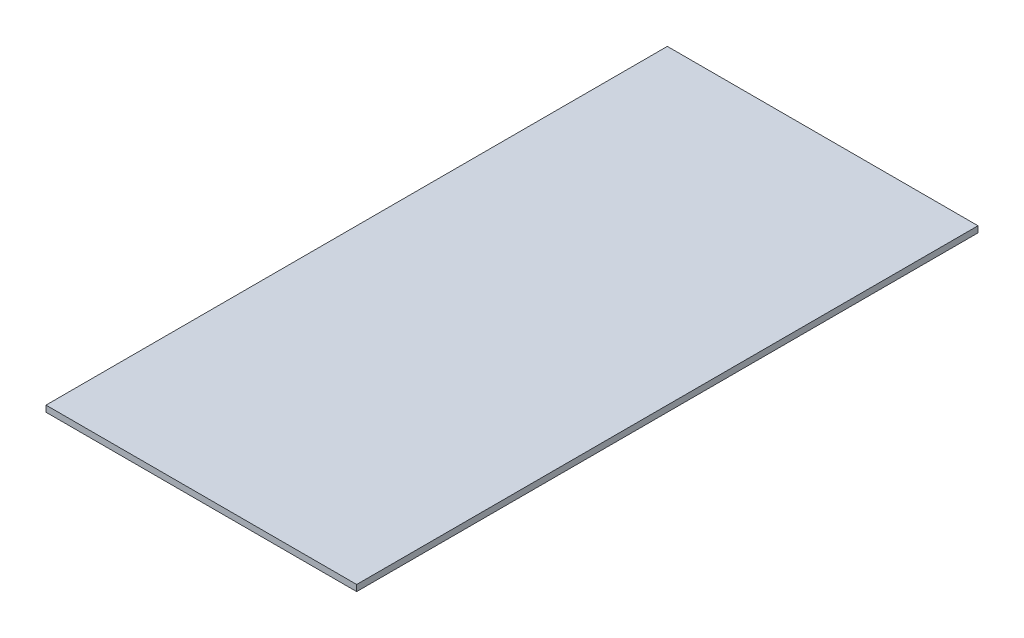
from build123d import *

# Parameters (mm, degrees)
SKETCH1_W           = 300
SKETCH1_H           = 600
BOSS_EXTRUDE1_DEPTH = 6


with BuildPart() as part:
    # Sketch1 → Boss-Extrude1 (new body)
    with BuildSketch(Plane(origin=(0, 0, 0), x_dir=(1, 0, 0), z_dir=(0, 1, 0))):
        with Locations((-5059.090909091, 2495.454545455)):
            Rectangle(SKETCH1_W, SKETCH1_H)
    extrude(amount=BOSS_EXTRUDE1_DEPTH)


solid = part.part
